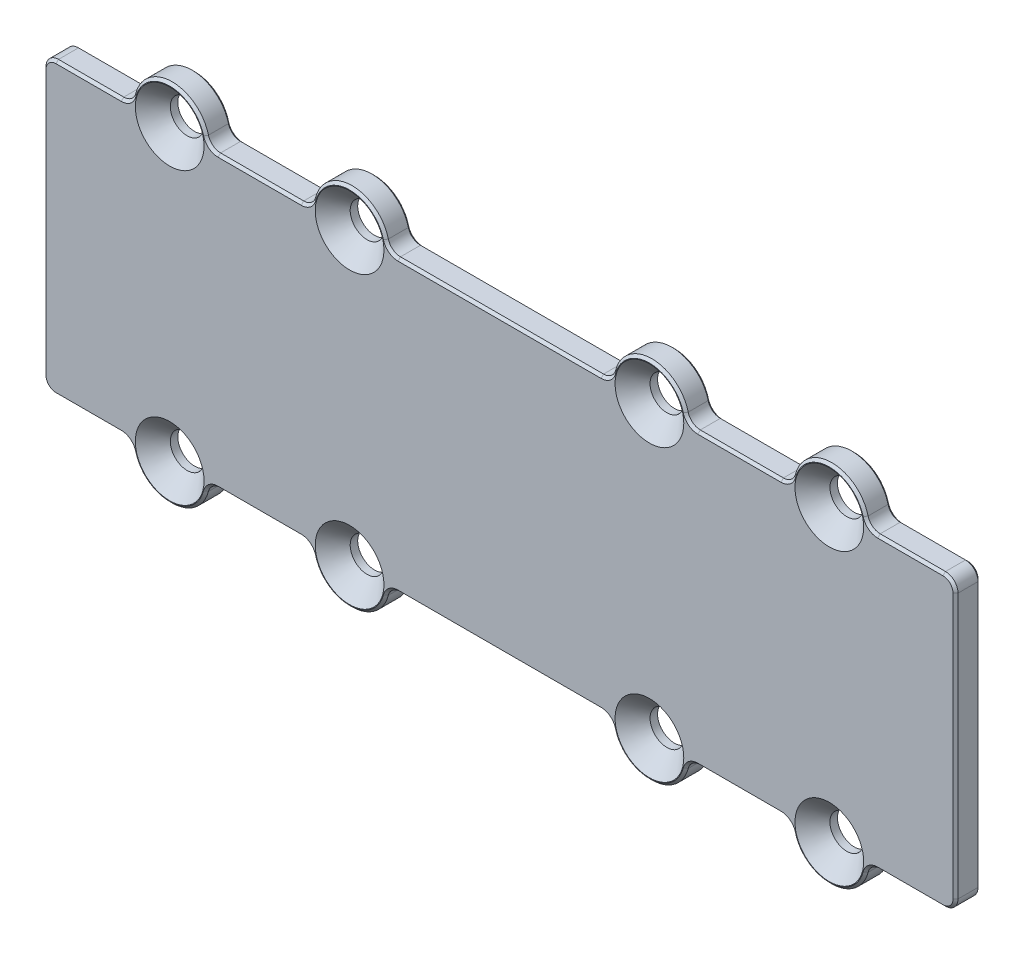
from build123d import *

# Parameters (mm, degrees)
SKETCH_1_R                     = 3
SKETCH_1_W                     = 73
SKETCH_1_H                     = 23.2
EXTRUDE_1_DEPTH                = 2
FILLET_1_R                     = 1
HOLE_WIZARD_M2_5_1_D           = 2.7
HOLE_WIZARD_M2_5_1_DEPTH       = 5.538838164
HOLE_WIZARD_M2_5_1_CSINK_D     = 5.5
HOLE_WIZARD_M2_5_1_CSINK_ANGLE = 90
HOLE_WIZARD_M2_5_1_TIP         = 0.811161836
CHAMFER_1_SIZE                 = 0.2


with BuildPart() as part:
    # 草图1 → 凸台-拉伸1 (new body)
    with BuildSketch(Plane.XY):
        with Locations((-26.4, 11.6)):
            Circle(SKETCH_1_R)
        with Locations((-12, 11.6)):
            Circle(SKETCH_1_R)
        with Locations((12, 11.6)):
            Circle(SKETCH_1_R)
        with Locations((26.4, 11.6)):
            Circle(SKETCH_1_R)
        with Locations((26.4, -11.6)):
            Circle(SKETCH_1_R)
        with Locations((12, -11.6)):
            Circle(SKETCH_1_R)
        with Locations((-12, -11.6)):
            Circle(SKETCH_1_R)
        with Locations((-26.4, -11.6)):
            Circle(SKETCH_1_R)
        Rectangle(SKETCH_1_W, SKETCH_1_H)
    extrude(amount=EXTRUDE_1_DEPTH)

    # 圆角1
    fillet_1_edges = [part.edges().sort_by_distance(p)[0] for p in [
        (29.4, 11.6, 1),
        (23.4, 11.6, 1),
        (23.4, -11.6, 1),
        (29.4, -11.6, 1),
        (9, -11.6, 1),
        (15, -11.6, 1),
        (-15, -11.6, 1),
        (-9, -11.6, 1),
        (-29.4, -11.6, 1),
        (-23.4, -11.6, 1),
        (-23.4, 11.6, 1),
        (-29.4, 11.6, 1),
        (-9, 11.6, 1),
        (-15, 11.6, 1),
        (-36.5, -11.6, 1),
        (36.5, -11.6, 1),
        (36.5, 11.6, 1),
        (-36.5, 11.6, 1),
        (9, 11.6, 1),
        (15, 11.6, 1),
    ]]
    fillet(fillet_1_edges, radius=FILLET_1_R)

    # M2.5 锥坑平头螺钉的锥形沉头孔1
    with Locations(Plane(origin=(-26.4, 11.6, 2), x_dir=(1, 0, 0), z_dir=(0, 0, 1))):
        with Locations((0, 0), (14.4, 0), (38.4, 0), (52.8, 0), (52.8, -23.2), (38.4, -23.2), (14.4, -23.2), (0, -23.2)):
            CounterSinkHole(HOLE_WIZARD_M2_5_1_D / 2, HOLE_WIZARD_M2_5_1_CSINK_D / 2, depth=HOLE_WIZARD_M2_5_1_DEPTH, counter_sink_angle=HOLE_WIZARD_M2_5_1_CSINK_ANGLE)
            with Locations((0, 0, -(HOLE_WIZARD_M2_5_1_DEPTH + HOLE_WIZARD_M2_5_1_TIP / 2))):  # 118° drill point
                Cone(0, HOLE_WIZARD_M2_5_1_D / 2, HOLE_WIZARD_M2_5_1_TIP, mode=Mode.SUBTRACT)

    # 倒角1
    chamfer_1_edges = [part.edges().sort_by_distance(p)[0] for p in [
        (-36.5, 0, 2),
        (-32.886491673, -11.6, 2),
        (-26.4, -14.6, 2),
        (-19.2, -11.6, 2),
        (-12, -14.6, 2),
        (0, -11.6, 2),
        (12, -14.6, 2),
        (19.2, -11.6, 2),
        (26.4, -14.6, 2),
        (32.886491673, -11.6, 2),
        (36.207106781, -11.307106781, 2),
        (-36.207106781, 11.307106781, 2),
        (-36.207106781, -11.307106781, 2),
        (36.207106781, 11.307106781, 2),
        (15.260610911, 11.809430585, 0),
        (15.260610911, 11.809430585, 2),
        (23.139389089, 11.809430585, 0),
        (23.139389089, 11.809430585, 2),
        (29.660610911, 11.809430585, 0),
        (29.660610911, 11.809430585, 2),
        (29.660610911, -11.809430585, 0),
        (29.660610911, -11.809430585, 2),
        (23.139389089, -11.809430585, 0),
        (23.139389089, -11.809430585, 2),
        (15.260610911, -11.809430585, 0),
        (15.260610911, -11.809430585, 2),
        (8.739389089, -11.809430585, 0),
        (8.739389089, -11.809430585, 2),
        (-8.739389089, -11.809430585, 0),
        (-8.739389089, -11.809430585, 2),
        (-15.260610911, -11.809430585, 0),
        (-15.260610911, -11.809430585, 2),
        (-23.139389089, -11.809430585, 0),
        (-23.139389089, -11.809430585, 2),
        (-29.660610911, -11.809430585, 0),
        (-29.660610911, -11.809430585, 2),
        (-29.660610911, 11.809430585, 0),
        (-29.660610911, 11.809430585, 2),
        (-23.139389089, 11.809430585, 2),
        (-23.139389089, 11.809430585, 0),
        (-15.260610911, 11.809430585, 0),
        (-15.260610911, 11.809430585, 2),
        (-8.739389089, 11.809430585, 2),
        (-8.739389089, 11.809430585, 0),
        (8.739389089, 11.809430585, 0),
        (8.739389089, 11.809430585, 2),
        (12, 14.6, 0),
        (12, 14.6, 2),
        (19.2, 11.6, 2),
        (19.2, 11.6, 0),
        (26.4, 14.6, 0),
        (26.4, 14.6, 2),
        (32.886491673, 11.6, 2),
        (32.886491673, 11.6, 0),
        (36.5, 0, 0),
        (32.886491673, -11.6, 0),
        (26.4, -14.6, 0),
        (19.2, -11.6, 0),
        (12, -14.6, 0),
        (0, -11.6, 0),
        (-12, -14.6, 0),
        (-19.2, -11.6, 0),
        (-26.4, -14.6, 0),
        (-32.886491673, -11.6, 0),
        (-36.5, 0, 0),
        (-32.886491673, 11.6, 0),
        (-26.4, 14.6, 0),
        (-19.2, 11.6, 0),
        (-12, 14.6, 0),
        (0, 11.6, 0),
        (36.207106781, -11.307106781, 0),
        (-36.207106781, 11.307106781, 0),
        (-36.207106781, -11.307106781, 0),
        (36.207106781, 11.307106781, 0),
        (36.5, 0, 2),
        (0, 11.6, 2),
        (-12, 14.6, 2),
        (-19.2, 11.6, 2),
        (-26.4, 14.6, 2),
        (-32.886491673, 11.6, 2),
    ]]
    chamfer(chamfer_1_edges, length=CHAMFER_1_SIZE)


solid = part.part
